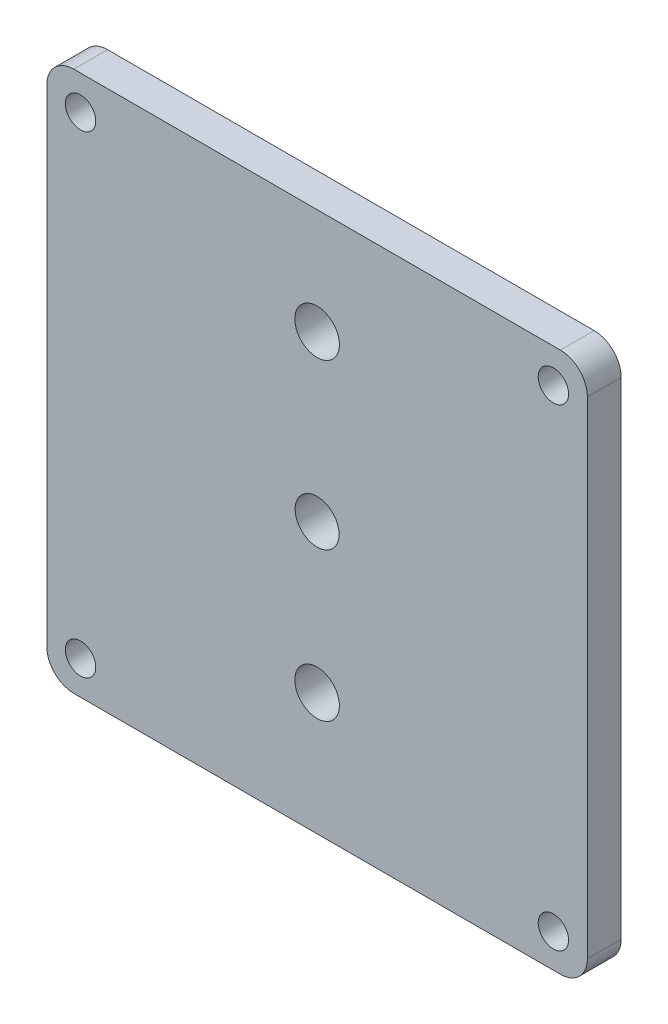
from build123d import *

# Parameters (mm, degrees)
BOSS_EXTRU_1_DEPTH      = 5
D_GAGEMENT_M41_D        = 4.5
ESQUISSE4_R             = 3.25
ENL_V_MAT_EXTRU_1_DEPTH = 57.789083458
D_GAGEMENT_M61_D        = 6.6


with BuildPart() as part:
    # Esquisse1 → Boss.-Extru.1 (new body)
    with BuildSketch(Plane.XY):
        with BuildLine():
            Line((-36, -40), (36, -40))
            ThreePointArc((36, -40), (38.828427125, -38.828427125), (40, -36))
            Line((40, -36), (40, 36))
            ThreePointArc((40, 36), (38.828427125, 38.828427125), (36, 40))
            Line((36, 40), (-36, 40))
            ThreePointArc((-36, 40), (-38.828427125, 38.828427125), (-40, 36))
            Line((-40, 36), (-40, -36))
            ThreePointArc((-40, -36), (-38.828427125, -38.828427125), (-36, -40))
        make_face()
    extrude(amount=BOSS_EXTRU_1_DEPTH)

    # Dégagement M41 (through all)
    with Locations(Plane.XY.offset(5)):
        with Locations((-35.007622699, 34.962380164), (34.968353645, 34.962380164), (34.968353645, -35.023881333), (-35.007622699, -35.023881333)):
            Hole(D_GAGEMENT_M41_D / 2)

    # Esquisse4 → Enlèv. mat.-Extru.1 (cut, through all)
    with BuildSketch(Plane(origin=(0, 0, 0), x_dir=(-1, 0, 0), z_dir=(0, 0, -1))):
        Circle(ESQUISSE4_R)
    extrude(amount=-ENL_V_MAT_EXTRU_1_DEPTH, mode=Mode.SUBTRACT)

    # Dégagement M61 (through all)
    with Locations(Plane(origin=(0, 0, 0), x_dir=(-1, 0, 0), z_dir=(0, 0, -1))):
        with Locations((0, -21.916448078), (0, 24.346376155)):
            Hole(D_GAGEMENT_M61_D / 2)


solid = part.part
